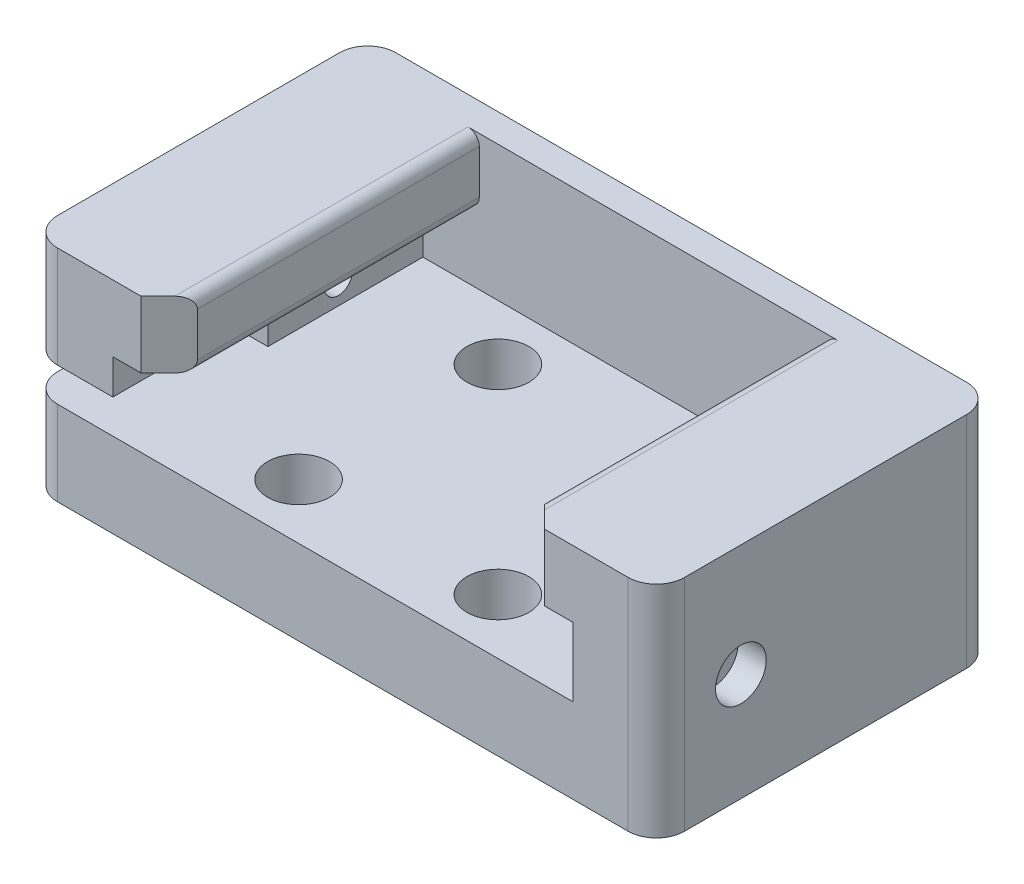
from build123d import *

# Parameters (mm, degrees)
SCHIZZO2_W                   = 111.2
SCHIZZO2_H                   = 55
ESTRUSIONE_ESTRUSIONE1_DEPTH = 15
SCHIZZO3_W                   = 14.8
SCHIZZO3_H                   = 55
ESTRUSIONE_ESTRUSIONE2_DEPTH = 24
SCHIZZO4_W                   = 55
SCHIZZO4_H                   = 11.8
ESTRUSIONE_ESTRUSIONE3_DEPTH = 10
SMUSSO1_SIZE                 = 5
SMUSSO2_SIZE                 = 5
FORO_6_0_6_1_D               = 6
SPECCHIA11_COPY_1_D          = 6
SCHIZZO10_R                  = 5.5
TAGLIO_ESTRUSIONE3_DEPTH     = 9
SPECCHIA13_COPY_1_SKETCH_R   = 5.5
SPECCHIA13_COPY_1_DEPTH      = 9
RACCORDO1_R                  = 2
CUT_EXTRUDE1_REACH           = 123.007
SKETCH2_W                    = 27.5
SKETCH2_H                    = 6
SKETCH3_W                    = 111.2
SKETCH3_H                    = 39
BOSS_EXTRUDE1_DEPTH          = 5
SKETCH5_R                    = 15.6
BOSS_EXTRUDE2_DEPTH          = 5.9
FILLET1_R                    = 1
FILLET2_R                    = 5
SCHIZZO11_R                  = 2.9
ESTRUSIONE_ESTRUSIONE4_DEPTH = 5.9
RACCORDO2_R                  = 1
CUT_EXTRUDE2_REACH           = 124.24
SKETCH6_R                    = 2.5
CUT_EXTRUDE3_REACH           = 124.24
SKETCH7_R                    = 2.5
SKETCH8_R                    = 4.5
CUT_EXTRUDE4_DEPTH           = 5
SKETCH9_R                    = 4.5
CUT_EXTRUDE5_DEPTH           = 5


with BuildPart() as part:
    # Schizzo2 → Estrusione-Estrusione1 (new body)
    with BuildSketch(Plane(origin=(0, 0, 0), x_dir=(1, 0, 0), z_dir=(0, 1, 0))):
        Rectangle(SCHIZZO2_W, SCHIZZO2_H)
    extrude(amount=ESTRUSIONE_ESTRUSIONE1_DEPTH)

    # Schizzo3 → Estrusione-Estrusione2 (add)
    with BuildSketch(Plane(origin=(0, 15, 0), x_dir=(1, 0, 0), z_dir=(0, 1, 0))):
        with Locations((48.2, 0)):
            Rectangle(SCHIZZO3_W, SCHIZZO3_H)
    estrusione_estrusione2 = extrude(amount=ESTRUSIONE_ESTRUSIONE2_DEPTH)

    # Schizzo4 → Estrusione-Estrusione3 (add)
    with BuildSketch(Plane.ZY.offset(-40.8)):
        with Locations((0, 33.1)):
            Rectangle(SCHIZZO4_W, SCHIZZO4_H)
    estrusione_estrusione3 = extrude(amount=ESTRUSIONE_ESTRUSIONE3_DEPTH)

    # Smusso1
    smusso1_edges = [part.edges().sort_by_distance(p)[0] for p in [
        (30.8, 33.1, 27.5),
    ]]
    chamfer(smusso1_edges, length=SMUSSO1_SIZE)

    # Specchia2: Estrusione-Estrusione2 across plane
    add(estrusione_estrusione2.mirror(Plane(origin=(0, 0, 0), x_dir=(0, 0, 1), z_dir=(1, 0, 0))))

    # Specchia3: Estrusione-Estrusione3 across plane
    add(estrusione_estrusione3.mirror(Plane(origin=(0, 0, 0), x_dir=(0, 0, 1), z_dir=(1, 0, 0))))

    # Smusso2
    smusso2_edges = [part.edges().sort_by_distance(p)[0] for p in [
        (-30.8, 33.1, 27.5),
    ]]
    chamfer(smusso2_edges, length=SMUSSO2_SIZE)

    # Foro Ø6.0 (6)-1 (through all)
    with Locations(Plane(origin=(0, 15, 0), x_dir=(1, 0, 0), z_dir=(0, 1, 0))):
        with Locations((17.67766953, 17.67766953)):
            foro_6_0_6_1 = Hole(FORO_6_0_6_1_D / 2)

    # Specchia10: Foro Ø6.0 (6)-1 across plane
    add(foro_6_0_6_1.mirror(Plane.XY), mode=Mode.SUBTRACT)

    # Specchia11: Foro Ø6.0 (6)-1 across plane
    add(foro_6_0_6_1.mirror(Plane(origin=(0, 0, 0), x_dir=(0, 0, 1), z_dir=(1, 0, 0))), mode=Mode.SUBTRACT)

    # Specchia11 copy 1 (through all)
    with Locations(Plane(origin=(0, 15, 0), x_dir=(-1, 0, 0), z_dir=(0, 1, 0))):
        with Locations((17.67766953, 17.67766953)):
            Hole(SPECCHIA11_COPY_1_D / 2)

    # Schizzo10 → Taglio-Estrusione3 (cut)
    with BuildSketch(Plane(origin=(0, 15, 0), x_dir=(1, 0, 0), z_dir=(0, 1, 0))):
        with Locations(Location((17.67766953, 17.67766953, 0), (0, 0, 270))):
            Circle(SCHIZZO10_R)
    taglio_estrusione3 = extrude(amount=-TAGLIO_ESTRUSIONE3_DEPTH, mode=Mode.SUBTRACT)

    # Specchia12: Taglio-Estrusione3 across plane
    add(taglio_estrusione3.mirror(Plane.XY), mode=Mode.SUBTRACT)

    # Specchia13: Taglio-Estrusione3 across plane
    add(taglio_estrusione3.mirror(Plane(origin=(0, 0, 0), x_dir=(0, 0, 1), z_dir=(1, 0, 0))), mode=Mode.SUBTRACT)

    # Specchia13 copy 1 sketch → Specchia13 copy 1 (cut)
    with BuildSketch(Plane(origin=(0, 15, 0), x_dir=(-1, 0, 0), z_dir=(0, 1, 0))):
        with Locations(Location((17.67766953, 17.67766953, 0), (0, 0, 270))):
            Circle(SPECCHIA13_COPY_1_SKETCH_R)
    extrude(amount=-SPECCHIA13_COPY_1_DEPTH, mode=Mode.SUBTRACT)

    # Raccordo1
    raccordo1_edges = [part.edges().sort_by_distance(p)[0] for p in [
        (30.8, 27.2, -2.5),
        (30.8, 39, -2.5),
        (-30.8, 27.2, -2.5),
        (-30.8, 39, -2.5),
    ]]
    fillet(raccordo1_edges, radius=RACCORDO1_R)

    # Sketch2 → Cut-Extrude1 (cut, up to next)
    with BuildSketch(Plane.ZY.offset(55.6), mode=Mode.PRIVATE) as cut_extrude1_sk1:
        with Locations((13.75, 18)):
            Rectangle(SKETCH2_W, SKETCH2_H)
    cut_extrude1_tool1 = extrude(cut_extrude1_sk1.sketch, amount=-CUT_EXTRUDE1_REACH, mode=Mode.PRIVATE) & part.part
    add(cut_extrude1_tool1.solids().sort_by_distance((-55.6, 18, 13.75))[0], mode=Mode.SUBTRACT)

    # Sketch3 → Boss-Extrude1 (add)
    with BuildSketch(Plane(origin=(0, 0, -27.5), x_dir=(-1, 0, 0), z_dir=(0, 0, -1))):
        with Locations((0, 19.5)):
            Rectangle(SKETCH3_W, SKETCH3_H)
    extrude(amount=BOSS_EXTRUDE1_DEPTH)

    # Sketch5 → Boss-Extrude2 (add)
    with BuildSketch(Plane.XZ):
        with Locations(Location((0, 0, 0), (0, 0, 270))):
            Circle(SKETCH5_R)
    extrude(amount=BOSS_EXTRUDE2_DEPTH)

    # Fillet1
    fillet1_edges = [part.edges().sort_by_distance(p)[0] for p in [
        (0, -5.9, 15.6),
    ]]
    fillet(fillet1_edges, radius=FILLET1_R)

    # Fillet2
    fillet2_edges = [part.edges().sort_by_distance(p)[0] for p in [
        (-55.6, 7.5, 27.5),
        (55.6, 19.5, -32.5),
        (-55.6, 19.5, -32.5),
        (55.6, 19.5, 27.5),
        (-55.6, 30, 27.5),
    ]]
    fillet(fillet2_edges, radius=FILLET2_R)

    # Schizzo11 → Estrusione-Estrusione4 (add)
    with BuildSketch(Plane.XZ):
        with Locations(Location((0, -25, 0), (0, 0, 270))):
            Circle(SCHIZZO11_R)
        with Locations(Location((-25, 0, 0), (0, 0, 270))):
            Circle(SCHIZZO11_R)
    extrude(amount=ESTRUSIONE_ESTRUSIONE4_DEPTH)

    # Raccordo2
    raccordo2_edges = [part.edges().sort_by_distance(p)[0] for p in [
        (0, -5.9, -22.1),
        (-25, -5.9, 2.9),
    ]]
    fillet(raccordo2_edges, radius=RACCORDO2_R)

    # Sketch6 → Cut-Extrude2 (cut, up to next)
    with BuildSketch(Plane.ZY.offset(55.6), mode=Mode.PRIVATE) as cut_extrude2_sk1:
        with Locations((-12.5, 19.1)):
            Circle(SKETCH6_R)
    cut_extrude2_tool1 = extrude(cut_extrude2_sk1.sketch, amount=-CUT_EXTRUDE2_REACH, mode=Mode.PRIVATE) & part.part
    add(cut_extrude2_tool1.solids().sort_by_distance((-55.6, 19.1, -12.5))[0], mode=Mode.SUBTRACT)

    # Sketch7 → Cut-Extrude3 (cut, up to next)
    with BuildSketch(Plane(origin=(55.6, 0, 0), x_dir=(0, 0, -1), z_dir=(1, 0, 0)), mode=Mode.PRIVATE) as cut_extrude3_sk1:
        with Locations((-12.5, 19.1)):
            Circle(SKETCH7_R)
    cut_extrude3_tool1 = extrude(cut_extrude3_sk1.sketch, amount=-CUT_EXTRUDE3_REACH, mode=Mode.PRIVATE) & part.part
    add(cut_extrude3_tool1.solids().sort_by_distance((55.6, 19.1, 12.5))[0], mode=Mode.SUBTRACT)

    # Sketch8 → Cut-Extrude4 (cut)
    with BuildSketch(Plane.ZY.offset(55.6)):
        with Locations((-12.5, 19.1)):
            Circle(SKETCH8_R)
    extrude(amount=-CUT_EXTRUDE4_DEPTH, mode=Mode.SUBTRACT)

    # Sketch9 → Cut-Extrude5 (cut)
    with BuildSketch(Plane(origin=(55.6, 0, 0), x_dir=(0, 0, -1), z_dir=(1, 0, 0))):
        with Locations((-12.5, 19.1)):
            Circle(SKETCH9_R)
    extrude(amount=-CUT_EXTRUDE5_DEPTH, mode=Mode.SUBTRACT)


solid = part.part
